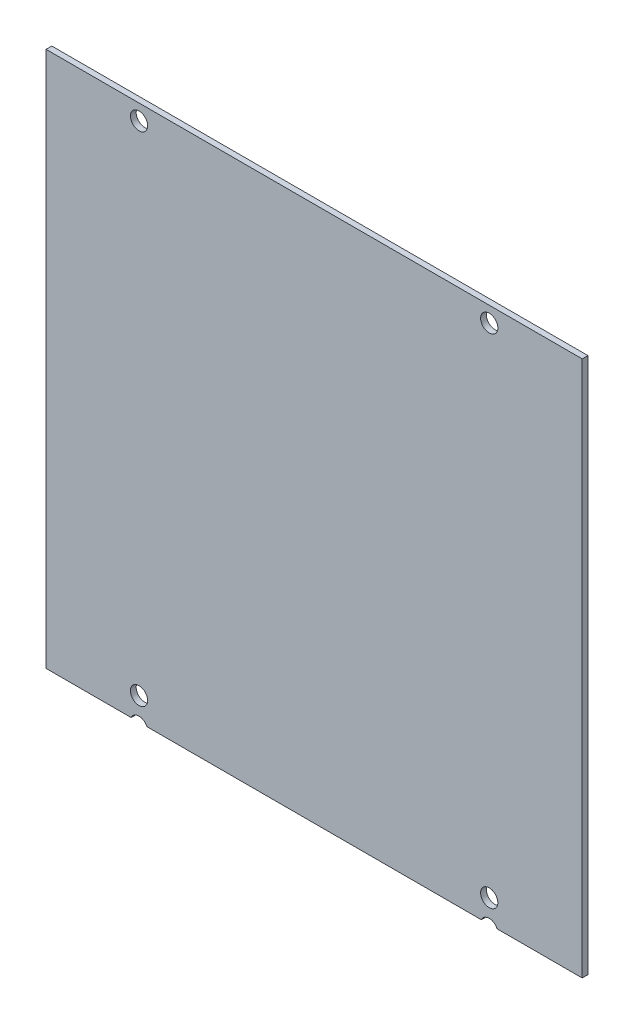
from build123d import *

# Parameters (mm, degrees)
SKETCH1_W                    = 93.4
SKETCH1_H                    = 93.4
BOSS_EXTRUDE1_DEPTH          = 1
F_3_0_3_DIAMETER_HOLE1_D     = 3
F_3_0_3_DIAMETER_HOLE1_DEPTH = 1


with BuildPart() as part:
    # Sketch1 → Boss-Extrude1 (new body)
    with BuildSketch(Plane.XY):
        Rectangle(SKETCH1_W, SKETCH1_H)
    extrude(amount=BOSS_EXTRUDE1_DEPTH)

    # Ø3.0 (3) Diameter Hole1
    with Locations(Plane.XY.offset(1)):
        with Locations((-30.5, -47.3), (30.5, -47.3), (30.5, -42.7), (-30.5, -42.7), (-30.5, 44), (30.5, 44), (-30.5, -66), (30.5, -66)):
            Hole(F_3_0_3_DIAMETER_HOLE1_D / 2, depth=F_3_0_3_DIAMETER_HOLE1_DEPTH)


solid = part.part
